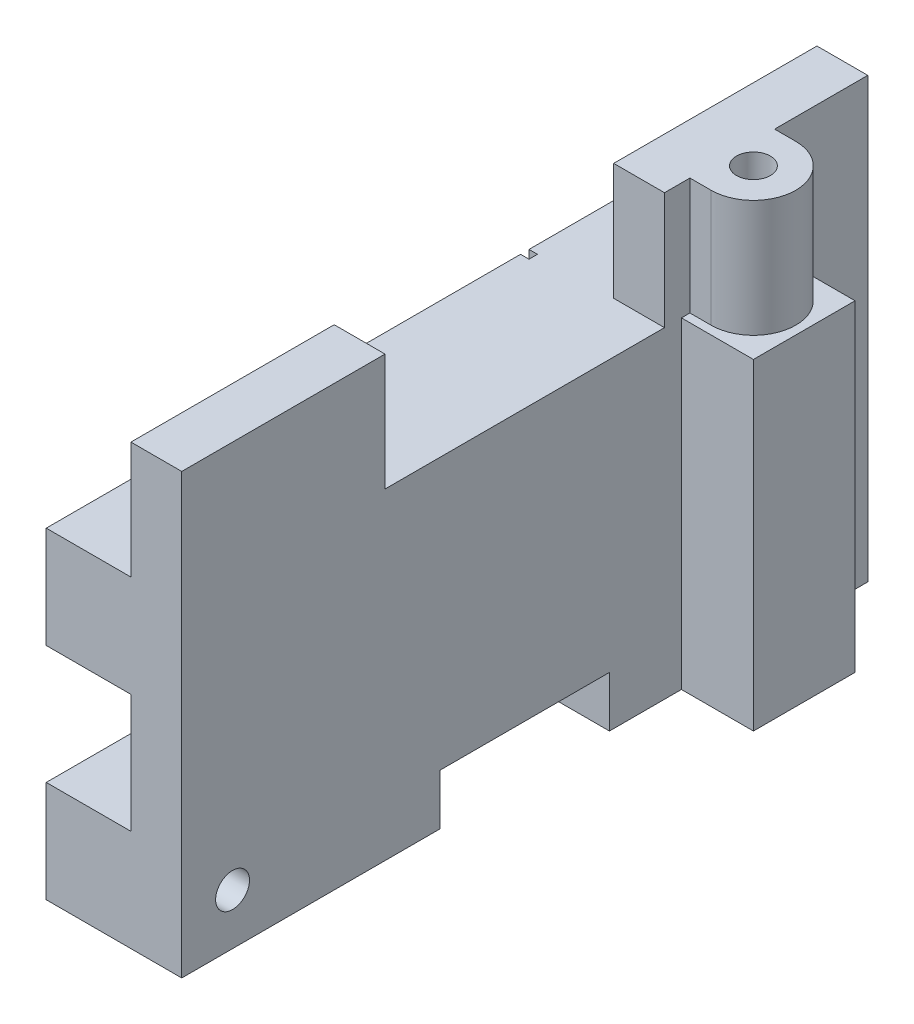
from build123d import *

# Parameters (mm, degrees)
EXTRUDE_1_DEPTH     = 40.5
SKETCH_2_W          = 4.25
SKETCH_2_H          = 6
SKETCH_2_R          = 1
EXTRUDE_2_DEPTH     = 19
EXTRUDE_START       = 6.9
SKETCH_6_W          = 3
SKETCH_6_H          = 12
SKETCH_6_R          = 1
EXTRUDE_3_DEPTH     = 6.9
SKETCH_7_W          = 10
SKETCH_7_H          = 3
CUT_EXTRUDE_1_DEPTH = 4
SKETCH_9_R          = 2
CUT_EXTRUDE_2_DEPTH = 2
SKETCH_10_R         = 1
CUT_EXTRUDE_3_DEPTH = 12
SKETCH_12_W         = 0.5
SKETCH_12_H         = 19
CUT_EXTRUDE_4_DEPTH = 0.5


with BuildPart() as part:
    # 草图1 → 凸台-拉伸1 (new body)
    with BuildSketch(Plane.XY):
        Polygon((3, -13), (-5, -13), (-5, -7), (0, -7), (0, 0), (-5, 0), (-5, 6), (3, 6), align=None)
    extrude(amount=EXTRUDE_1_DEPTH)

    # 草图2 → 凸台-拉伸2 (add)
    with BuildSketch(Plane(origin=(0, 6, 0), x_dir=(1, 0, 0), z_dir=(0, 1, 0))):
        with Locations((5.125, -8)):
            Rectangle(SKETCH_2_W, SKETCH_2_H)
        with Locations(Location((4.25, -8, 0), (0, 0, 270))):
            Circle(SKETCH_2_R, mode=Mode.SUBTRACT)
    extrude(amount=-EXTRUDE_2_DEPTH)

    # 草图6 → 凸台-拉伸3 (add)
    # profile 1 of 2: a face of its own
    with BuildSketch(Plane(origin=(0, 6, 0), x_dir=(1, 0, 0), z_dir=(0, 1, 0)).offset(EXTRUDE_START)):
        with Locations((1.5, -34.5)):
            Rectangle(SKETCH_6_W, SKETCH_6_H)
    # profile 2 of 2: a face of its own
    with BuildSketch(Plane(origin=(0, 6, 0), x_dir=(1, 0, 0), z_dir=(0, 1, 0)).offset(EXTRUDE_START)):
        with BuildLine():
            Line((4.25, -10.5), (3, -10.5))
            Line((3, -10.5), (3, -12))
            Line((3, -12), (0, -12))
            Line((0, -12), (0, 0))
            Line((0, 0), (3, 0))
            Line((3, 0), (3, -5.5))
            Line((3, -5.5), (4.25, -5.5))
            ThreePointArc((4.25, -5.5), (6.75, -8), (4.25, -10.5))
        make_face()
        with Locations(Location((4.25, -8, 0), (0, 0, 270))):
            Circle(SKETCH_6_R, mode=Mode.SUBTRACT)
    extrude(amount=-EXTRUDE_3_DEPTH)

    # 草图7 → 切除-拉伸1 (cut)
    with BuildSketch(Plane(origin=(3, 0, 0), x_dir=(0, 0, -1), z_dir=(1, 0, 0))):
        with Locations((-20.25, -11.5)):
            Rectangle(SKETCH_7_W, SKETCH_7_H)
    extrude(amount=-CUT_EXTRUDE_1_DEPTH, mode=Mode.SUBTRACT)

    # 草图9 → 切除-拉伸2 (cut)
    with BuildSketch(Plane.ZY.offset(5)):
        with Locations((37.5, -10)):
            Circle(SKETCH_9_R)
        with Locations((3, -10)):
            Circle(SKETCH_9_R)
    extrude(amount=-CUT_EXTRUDE_2_DEPTH, mode=Mode.SUBTRACT)

    # 草图10 → 切除-拉伸3 (cut)
    with BuildSketch(Plane.ZY.offset(3)):
        with Locations((37.5, -10)):
            Circle(SKETCH_10_R)
        with Locations((3, -10)):
            Circle(SKETCH_10_R)
    extrude(amount=-CUT_EXTRUDE_3_DEPTH, mode=Mode.SUBTRACT)

    # 草图12 → 切除-拉伸4 (cut)
    with BuildSketch(Plane.ZY.offset(5)):
        with Locations((12.25, -3.5)):
            Rectangle(SKETCH_12_W, SKETCH_12_H)
        with Locations((28.25, -3.5)):
            Rectangle(SKETCH_12_W, SKETCH_12_H)
    extrude(amount=-CUT_EXTRUDE_4_DEPTH, mode=Mode.SUBTRACT)


solid = part.part
